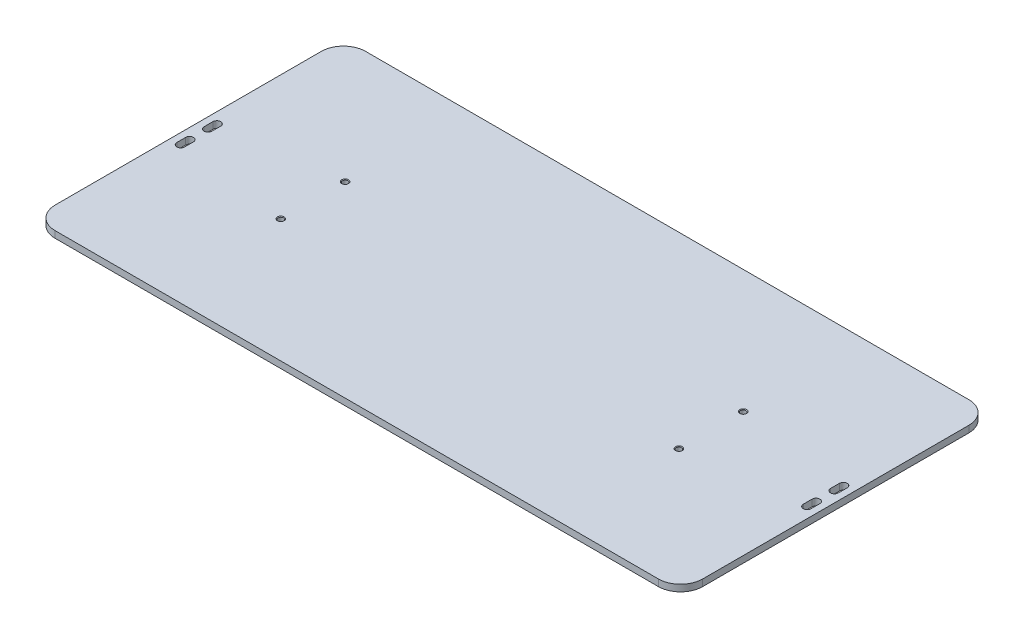
from build123d import *

# Parameters (mm, degrees)
SKETCH_1_W                   = 292
SKETCH_1_H                   = 140
EXTRUDE_1_DEPTH              = 3
HOLE_WIZARD_M3_1_D           = 2.5
HOLE_WIZARD_M3_1_CSINK_D     = 3.05
HOLE_WIZARD_M3_1_CSINK_ANGLE = 90
MIRROR_2_COPY_1_D            = 2.5
MIRROR_2_COPY_1_CSINK_D      = 3.05
MIRROR_2_COPY_1_CSINK_ANGLE  = 90
FILLET_1_R                   = 10


with BuildPart() as part:
    # 草图1 → 凸台-拉伸1 (new body)
    with BuildSketch(Plane(origin=(0, 0, 0), x_dir=(1, 0, 0), z_dir=(0, 1, 0))):
        Rectangle(SKETCH_1_W, SKETCH_1_H)
        with BuildLine():
            Line((-139.48, 8.14), (-139.48, 4.16))
            ThreePointArc((-139.48, 4.16), (-141.24, 2.4), (-143, 4.16))
            Line((-143, 4.16), (-143, 8.14))
            ThreePointArc((-143, 8.14), (-141.24, 9.9), (-139.48, 8.14))
        make_face(mode=Mode.SUBTRACT)
        with BuildLine():
            Line((-139.48, -8.14), (-139.48, -4.16))
            ThreePointArc((-139.48, -4.16), (-141.24, -2.4), (-143, -4.16))
            Line((-143, -4.16), (-143, -8.14))
            ThreePointArc((-143, -8.14), (-141.24, -9.9), (-139.48, -8.14))
        make_face(mode=Mode.SUBTRACT)
        with BuildLine():
            Line((139.48, 8.14), (139.48, 4.16))
            ThreePointArc((139.48, 4.16), (141.24, 2.4), (143, 4.16))
            Line((143, 4.16), (143, 8.14))
            ThreePointArc((143, 8.14), (141.24, 9.9), (139.48, 8.14))
        make_face(mode=Mode.SUBTRACT)
        with BuildLine():
            Line((139.48, -8.14), (139.48, -4.16))
            ThreePointArc((139.48, -4.16), (141.24, -2.4), (143, -4.16))
            Line((143, -4.16), (143, -8.14))
            ThreePointArc((143, -8.14), (141.24, -9.9), (139.48, -8.14))
        make_face(mode=Mode.SUBTRACT)
    extrude(amount=EXTRUDE_1_DEPTH)

    # M3 螺纹孔1 (through all)
    with Locations(Plane(origin=(-89.75, 3, -14.5), x_dir=(0, 0, 1), z_dir=(0, 1, 0))):
        with Locations((0, 0)):
            hole_wizard_m3_1 = CounterSinkHole(HOLE_WIZARD_M3_1_D / 2, HOLE_WIZARD_M3_1_CSINK_D / 2, counter_sink_angle=HOLE_WIZARD_M3_1_CSINK_ANGLE)

    # 镜向1: M3 螺纹孔1 across plane
    add(hole_wizard_m3_1.mirror(Plane(origin=(0, 0, 0), x_dir=(0, 0, 1), z_dir=(1, 0, 0))), mode=Mode.SUBTRACT)

    # 镜向2: M3 螺纹孔1 across plane
    add(hole_wizard_m3_1.mirror(Plane.XY), mode=Mode.SUBTRACT)

    # 镜向2 copy 1 (through all)
    with Locations(Plane(origin=(89.75, 3, 14.5), x_dir=(0, 0, -1), z_dir=(0, 1, 0))):
        with Locations((0, 0)):
            CounterSinkHole(MIRROR_2_COPY_1_D / 2, MIRROR_2_COPY_1_CSINK_D / 2, counter_sink_angle=MIRROR_2_COPY_1_CSINK_ANGLE)

    # 圆角1
    fillet_1_edges = [part.edges().sort_by_distance(p)[0] for p in [
        (146, 1.5, 70),
        (-146, 1.5, 70),
        (-146, 1.5, -70),
        (146, 1.5, -70),
    ]]
    fillet(fillet_1_edges, radius=FILLET_1_R)


solid = part.part
